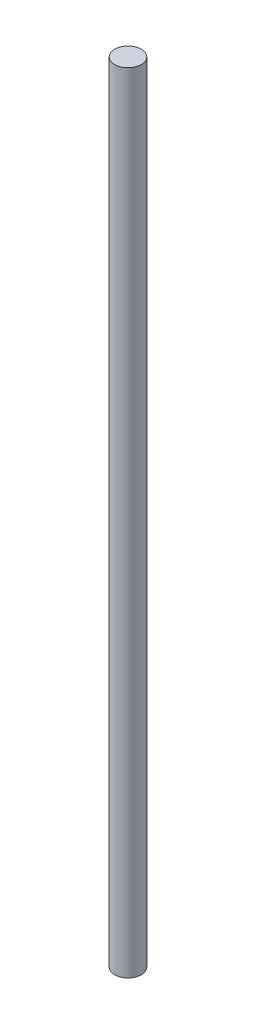
from build123d import *

# Parameters (mm, degrees)
SKETCH1_R           = 0.675
BOSS_EXTRUDE1_DEPTH = 40


with BuildPart() as part:
    # Sketch1 → Boss-Extrude1 (new body)
    with BuildSketch(Plane(origin=(0, 0, 0), x_dir=(1, 0, 0), z_dir=(0, 1, 0))):
        with Locations(Location((0, 0, 0), (0, 0, 270))):
            Circle(SKETCH1_R)
    extrude(amount=BOSS_EXTRUDE1_DEPTH)


solid = part.part
